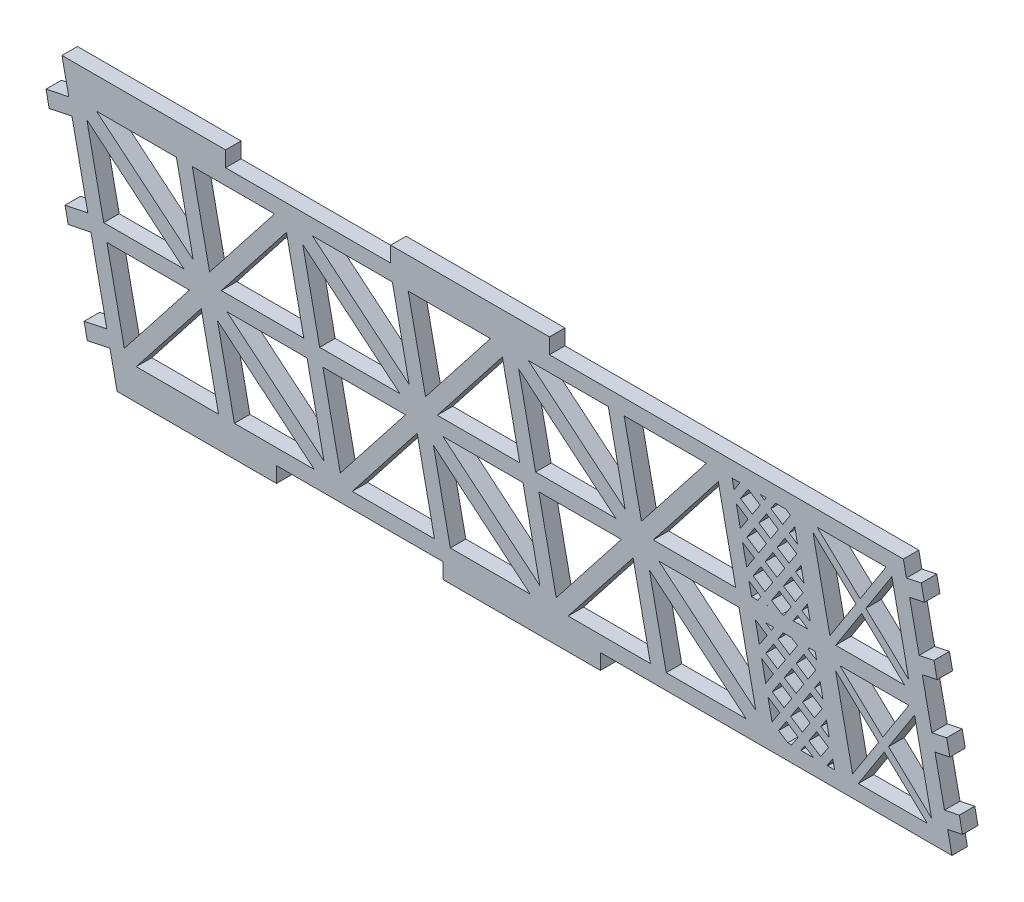
from build123d import *

# Parameters (mm, degrees)
BOSS_EXTRUDE1_DEPTH = 3


with BuildPart() as part:
    # Sketch1 → Boss-Extrude1 (new body)
    with BuildSketch(Plane.XY):
        Polygon((302.702227254, 245.999999999), (333.574773745, 245.999999999), (333.574773745, 248.999999999), (365.824773745, 248.999999999), (365.824773745, 245.999999999), (396.274773745, 245.999999999), (396.274773745, 248.999999999), (464.334974622, 248.999999999), (463.508181793, 252.953087284), (466.378881972, 253.553497585), (465.764717751, 256.489958432), (462.894017572, 255.889548132), (461.051524909, 264.698930675), (463.922225088, 265.299340975), (463.308060867, 268.235801823), (460.437360688, 267.635391523), (458.594868025, 276.444774066), (461.465568204, 277.045184366), (460.851403983, 279.981645213), (457.980703804, 279.381234913), (456.138211141, 288.190617456), (459.00891132, 288.791027756), (458.394747099, 291.727488604), (455.52404692, 291.127078304), (454.923171987, 293.999999999), (386.412971109, 293.999999999), (386.412971109, 296.999999999), (355.662971109, 296.999999999), (355.662971109, 293.999999999), (323.712971109, 293.999999999), (323.712971109, 296.999999999), (292.0355176, 296.999999999), (293.348293623, 290.723314937), (288.943602351, 289.802068606), (289.557766572, 286.865607758), (293.962457844, 287.78685409), (297.033278948, 273.104549851), (292.628587677, 272.18330352), (293.242751898, 269.246842672), (297.647443169, 270.168089004), (300.718264274, 255.485784766), (296.313573003, 254.564538434), (296.927737224, 251.628077586), (301.332428495, 252.549323918), align=None)
        Polygon((423.308182855, 290.999999999), (421.767934038, 290.999999999), (422.141130658, 289.215660849), align=None, mode=Mode.SUBTRACT)
        Polygon((427.192996507, 289.18865376), (425.691755726, 286.893364223), (423.39646619, 288.394605003), (424.89770697, 290.68989454), align=None, mode=Mode.SUBTRACT)
        Polygon((422.575410343, 287.139269471), (423.3694591, 283.342739154), (424.87069988, 285.638028691), align=None, mode=Mode.SUBTRACT)
        Polygon((428.377712769, 290.999999999), (427.163951839, 290.999999999), (428.014052353, 290.443989291), align=None, mode=Mode.SUBTRACT)
        Polygon((432.174525784, 290.999999999), (433.065918202, 290.416982202), (431.564677422, 288.121692665), (429.269387885, 289.622933445), (430.170062259, 290.999999999), align=None, mode=Mode.SUBTRACT)
        Polygon((430.743621575, 286.866357133), (429.242380795, 284.571067596), (426.947091258, 286.072308376), (428.448332038, 288.367597913), align=None, mode=Mode.SUBTRACT)
        Polygon((428.421324949, 283.315732064), (426.920084168, 281.020442527), (424.624794632, 282.521683308), (426.126035412, 284.816972845), align=None, mode=Mode.SUBTRACT)
        Polygon((423.803738785, 281.266347776), (424.597787542, 277.469817459), (426.099028322, 279.765106996), align=None, mode=Mode.SUBTRACT)
        Polygon((434.448901141, 286.235257774), (432.820012953, 287.300636818), (433.885391998, 288.929525006), align=None, mode=Mode.SUBTRACT)
        Polygon((434.294246644, 284.544060506), (432.793005864, 282.248770969), (430.497716327, 283.75001175), (431.998957107, 286.045301287), align=None, mode=Mode.SUBTRACT)
        Polygon((431.971950017, 280.993435438), (430.470709237, 278.698145901), (428.1754197, 280.199386681), (429.67666048, 282.494676218), align=None, mode=Mode.SUBTRACT)
        Polygon((429.649653391, 277.442810369), (428.14841261, 275.147520832), (425.853123073, 276.648761613), (427.354363854, 278.944051149), align=None, mode=Mode.SUBTRACT)
        Polygon((425.032067227, 275.393426081), (425.532655092, 272.999999999), (426.743820379, 272.999999999), (427.327356764, 273.8921853), align=None, mode=Mode.SUBTRACT)
        Polygon((435.677229583, 280.362336079), (434.048341395, 281.427715123), (435.11372044, 283.05660331), align=None, mode=Mode.SUBTRACT)
        Polygon((435.522575086, 278.671138811), (434.021334306, 276.375849274), (431.726044769, 277.877090055), (433.227285549, 280.172379591), align=None, mode=Mode.SUBTRACT)
        Polygon((433.200278459, 275.120513742), (431.813350294, 272.999999999), (431.43181802, 272.999999999), (429.403748142, 274.326464986), (430.904988922, 276.621754523), align=None, mode=Mode.SUBTRACT)
        Polygon((428.691444134, 272.999999999), (428.536169869, 272.999999999), (428.582692296, 273.071129454), align=None, mode=Mode.SUBTRACT)
        Polygon((426.260395669, 269.520504386), (427.054444426, 265.723974068), (428.555685206, 268.019263605), align=None, mode=Mode.SUBTRACT)
        Polygon((436.905558025, 274.489414383), (435.276669837, 275.554793428), (436.342048882, 277.183681615), align=None, mode=Mode.SUBTRACT)
        Polygon((436.442391964, 272.999999999), (433.605699783, 272.999999999), (434.455613991, 274.299457896), align=None, mode=Mode.SUBTRACT)
        Polygon((433.278229079, 269.999999999), (434.428606901, 269.247592047), (432.927366121, 266.95230251), (430.632076584, 268.453543291), (431.64354108, 269.999999999), align=None, mode=Mode.SUBTRACT)
        Polygon((432.106310275, 265.696966979), (430.605069494, 263.401677442), (428.309779957, 264.902918222), (429.811020738, 267.198207759), align=None, mode=Mode.SUBTRACT)
        Polygon((427.488724111, 263.64758269), (428.282772868, 259.851052373), (429.784013648, 262.14634191), align=None, mode=Mode.SUBTRACT)
        Polygon((428.267655135, 269.999999999), (429.85119159, 269.999999999), (429.376741052, 269.274599137), align=None, mode=Mode.SUBTRACT)
        Polygon((437.844524294, 269.999999999), (438.133886467, 268.616492688), (436.504998279, 269.681871733), (436.713070995, 269.999999999), align=None, mode=Mode.SUBTRACT)
        Polygon((437.97923197, 266.925295421), (436.477991189, 264.630005884), (434.182701653, 266.131246664), (435.683942433, 268.426536201), align=None, mode=Mode.SUBTRACT)
        Polygon((435.656935343, 263.374670352), (434.155694563, 261.079380815), (431.860405026, 262.580621595), (433.361645806, 264.875911132), align=None, mode=Mode.SUBTRACT)
        Polygon((433.334638716, 259.824045283), (431.833397936, 257.528755746), (429.538108399, 259.029996527), (431.03934918, 261.325286064), align=None, mode=Mode.SUBTRACT)
        Polygon((428.717052553, 257.774660995), (429.51110131, 253.978130678), (431.01234209, 256.273420215), align=None, mode=Mode.SUBTRACT)
        Polygon((439.362214909, 262.743570993), (437.733326721, 263.808950037), (438.798705766, 265.437838225), align=None, mode=Mode.SUBTRACT)
        Polygon((439.207560412, 261.052373725), (437.706319631, 258.757084188), (435.411030095, 260.258324969), (436.912270875, 262.553614506), align=None, mode=Mode.SUBTRACT)
        Polygon((436.885263785, 257.501748657), (435.384023005, 255.20645912), (433.088733468, 256.7076999), (434.589974248, 259.002989437), align=None, mode=Mode.SUBTRACT)
        Polygon((434.562967158, 253.951123588), (433.286829115, 251.999999999), (432.535521316, 251.999999999), (430.766436841, 253.157074832), (432.267677622, 255.452364368), align=None, mode=Mode.SUBTRACT)
        Polygon((440.590543351, 256.870649298), (438.961655163, 257.936028342), (440.027034208, 259.564916529), align=None, mode=Mode.SUBTRACT)
        Polygon((440.435888854, 255.17945203), (438.934648073, 252.884162493), (436.639358537, 254.385403273), (438.140599317, 256.68069281), align=None, mode=Mode.SUBTRACT)
        Polygon((437.54609526, 251.999999999), (435.079178605, 251.999999999), (435.81830269, 253.130067742), align=None, mode=Mode.SUBTRACT)
        Polygon((441.609245348, 251.999999999), (440.286469146, 251.999999999), (440.189983605, 252.063106647), (441.25536265, 253.691994834), align=None, mode=Mode.SUBTRACT)
        Polygon((460.374039252, 253.284084848), (452.065449292, 261.118562218), (457.096859041, 268.953039589), align=None, mode=Mode.SUBTRACT)
        Polygon((459.549382198, 251.999999999), (446.20938249, 251.999999999), (451.240792238, 259.834477369), align=None, mode=Mode.SUBTRACT)
        Polygon((441.82188383, 268.71591515), (450.13047379, 260.881437779), (445.099064042, 253.046960409), align=None, mode=Mode.SUBTRACT)
        Polygon((442.646540884, 269.999999999), (455.986540593, 269.999999999), (450.955130844, 262.165522628), align=None, mode=Mode.SUBTRACT)
        Polygon((455.981864689, 274.284084848), (447.673274729, 282.118562218), (452.704684478, 289.953039589), align=None, mode=Mode.SUBTRACT)
        Polygon((437.429709267, 289.71591515), (445.738299227, 281.881437779), (440.706889479, 274.046960409), align=None, mode=Mode.SUBTRACT)
        Polygon((451.59436603, 290.999999999), (438.254366321, 290.999999999), (446.562956281, 283.165522628), align=None, mode=Mode.SUBTRACT)
        Polygon((455.157207635, 272.999999999), (441.817207926, 272.999999999), (446.848617675, 280.834477369), align=None, mode=Mode.SUBTRACT)
        Polygon((400.865834803, 290.999999999), (416.79683168, 290.999999999), (404.220245718, 274.961787447), align=None, mode=Mode.SUBTRACT)
        Polygon((422.467741079, 272.999999999), (406.494259674, 272.999999999), (419.104384675, 289.080982999), align=None, mode=Mode.SUBTRACT)
        Polygon((390.02681953, 251.999999999), (405.957816408, 251.999999999), (402.603405493, 268.038212551), align=None, mode=Mode.SUBTRACT)
        Polygon((384.355910132, 269.999999999), (400.329391536, 269.999999999), (387.719266536, 253.919016999), align=None, mode=Mode.SUBTRACT)
        Polygon((359.061636334, 290.999999999), (374.992633211, 290.999999999), (362.416047249, 274.961787447), align=None, mode=Mode.SUBTRACT)
        Polygon((380.66354261, 272.999999999), (364.690061206, 272.999999999), (377.300186206, 289.080982999), align=None, mode=Mode.SUBTRACT)
        Polygon((348.222621062, 251.999999999), (364.153617939, 251.999999999), (360.799207024, 268.038212551), align=None, mode=Mode.SUBTRACT)
        Polygon((342.551711663, 269.999999999), (358.525193068, 269.999999999), (345.915068067, 253.919016999), align=None, mode=Mode.SUBTRACT)
        Polygon((317.257437866, 290.999999999), (333.188434743, 290.999999999), (320.61184878, 274.961787447), align=None, mode=Mode.SUBTRACT)
        Polygon((338.859344141, 272.999999999), (322.885862737, 272.999999999), (335.495987737, 289.080982999), align=None, mode=Mode.SUBTRACT)
        Polygon((322.34941947, 251.999999999), (306.418422593, 251.999999999), (318.995008555, 268.038212551), align=None, mode=Mode.SUBTRACT)
        Polygon((300.747513194, 269.999999999), (316.720994599, 269.999999999), (304.110869598, 253.919016999), align=None, mode=Mode.SUBTRACT)
        Polygon((296.849292196, 288.638294034), (300.120059685, 272.999999999), (315.653811506, 272.999999999), align=None, mode=Mode.SUBTRACT)
        Polygon((298.701256559, 290.999999999), (314.192523853, 290.999999999), (317.454345852, 275.404476413), align=None, mode=Mode.SUBTRACT)
        Polygon((325.414333483, 251.999999999), (322.152511483, 267.595523585), (340.905600776, 251.999999999), align=None, mode=Mode.SUBTRACT)
        Polygon((339.48679765, 269.999999999), (342.757565139, 254.361705964), (323.953045829, 269.999999999), align=None, mode=Mode.SUBTRACT)
        Polygon((357.458009975, 272.999999999), (341.924258154, 272.999999999), (338.653490665, 288.638294034), align=None, mode=Mode.SUBTRACT)
        Polygon((340.505455028, 290.999999999), (355.996722322, 290.999999999), (359.258544321, 275.404476413), align=None, mode=Mode.SUBTRACT)
        Polygon((367.218531952, 251.999999999), (363.956709952, 267.595523585), (382.709799245, 251.999999999), align=None, mode=Mode.SUBTRACT)
        Polygon((381.290996119, 269.999999999), (384.561763608, 254.361705964), (365.757244298, 269.999999999), align=None, mode=Mode.SUBTRACT)
        Polygon((399.262208444, 272.999999999), (383.728456623, 272.999999999), (380.457689134, 288.638294034), align=None, mode=Mode.SUBTRACT)
        Polygon((382.309653497, 290.999999999), (397.80092079, 290.999999999), (401.06274279, 275.404476413), align=None, mode=Mode.SUBTRACT)
        Polygon((409.02273042, 251.999999999), (405.760908421, 267.595523585), (424.513997714, 251.999999999), align=None, mode=Mode.SUBTRACT)
        Polygon((423.095194588, 269.999999999), (426.365962077, 254.361705964), (407.561442767, 269.999999999), align=None, mode=Mode.SUBTRACT)
    extrude(amount=BOSS_EXTRUDE1_DEPTH)


solid = part.part
